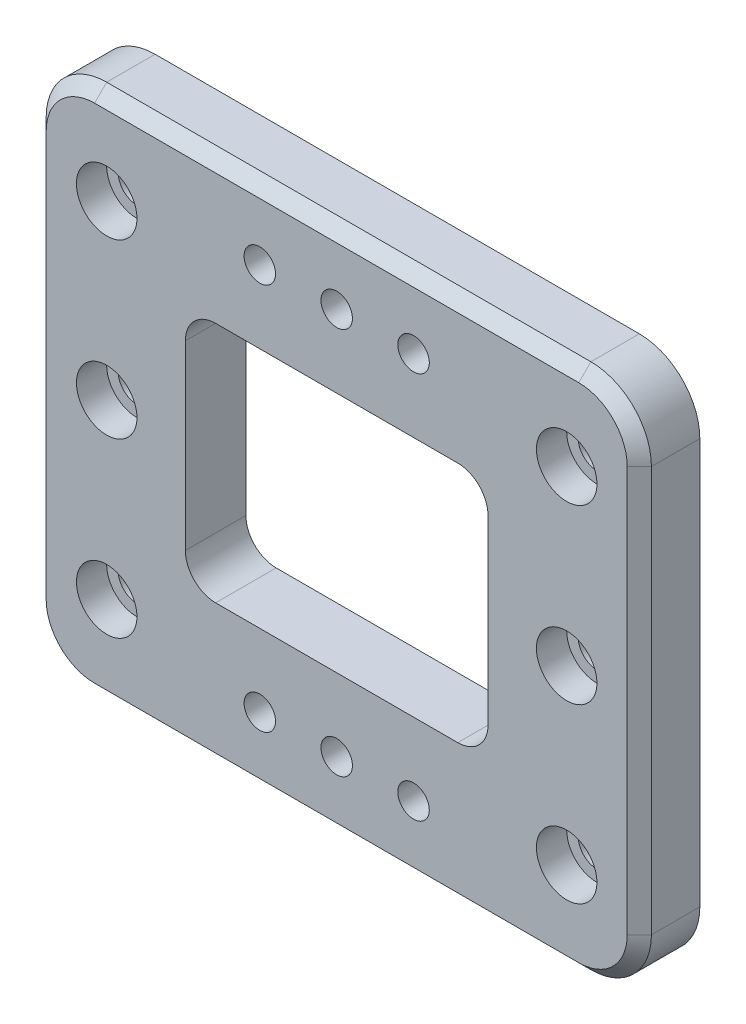
from build123d import *

# Parameters (mm, degrees)
SKETCH_1_W          = 100
SKETCH_1_H          = 87
EXTRUDE_1_DEPTH     = 10
FILLET_1_R          = 10
SKETCH_2_R          = 2.6
CUT_EXTRUDE_1_DEPTH = 10
SKETCH_3_R          = 5
CUT_EXTRUDE_2_DEPTH = 5
SKETCH_4_R          = 3.1
CUT_EXTRUDE_3_DEPTH = 5
CHAMFER_1_SIZE      = 1
CHAMFER_2_SIZE      = 2
SKETCH1_W           = 50
SKETCH1_H           = 40
CUT_EXTRUDE1_DEPTH  = 10
FILLET1_R           = 5


with BuildPart() as part:
    # 草图1 → 凸台-拉伸1 (new body)
    with BuildSketch(Plane.XY):
        Rectangle(SKETCH_1_W, SKETCH_1_H)
    extrude(amount=EXTRUDE_1_DEPTH)

    # 圆角1
    fillet_1_edges = [part.edges().sort_by_distance(p)[0] for p in [
        (50, -43.5, 5),
        (-50, -43.5, 5),
        (-50, 43.5, 5),
        (50, 43.5, 5),
    ]]
    fillet(fillet_1_edges, radius=FILLET_1_R)

    # 草图2 → 切除-拉伸1 (cut)
    with BuildSketch(Plane.XY.offset(10)):
        with Locations((0, 32)):
            Circle(SKETCH_2_R)
        with Locations((-12.7, 32)):
            Circle(SKETCH_2_R)
        with Locations(Location((12.7, 32, 0), (0, 0, 180))):
            Circle(SKETCH_2_R)
        with Locations((-12.7, -32)):
            Circle(SKETCH_2_R)
        with Locations((0, -32)):
            Circle(SKETCH_2_R)
        with Locations((12.7, -32)):
            Circle(SKETCH_2_R)
    extrude(amount=-CUT_EXTRUDE_1_DEPTH, mode=Mode.SUBTRACT)

    # 草图3 → 切除-拉伸2 (cut)
    with BuildSketch(Plane.XY.offset(10)):
        with Locations((-38, 28.5)):
            Circle(SKETCH_3_R)
        with Locations((-38, 0)):
            Circle(SKETCH_3_R)
        with Locations((-38, -28.5)):
            Circle(SKETCH_3_R)
        with Locations(Location((38, -28.5, 0), (0, 0, 180))):
            Circle(SKETCH_3_R)
        with Locations(Location((38, 0, 0), (0, 0, 180))):
            Circle(SKETCH_3_R)
        with Locations(Location((38, 28.5, 0), (0, 0, 180))):
            Circle(SKETCH_3_R)
    extrude(amount=-CUT_EXTRUDE_2_DEPTH, mode=Mode.SUBTRACT)

    # 草图4 → 切除-拉伸3 (cut)
    with BuildSketch(Plane.XY.offset(5)):
        with Locations((-38, 28.5)):
            Circle(SKETCH_4_R)
        with Locations((-38, 0)):
            Circle(SKETCH_4_R)
        with Locations((-38, -28.5)):
            Circle(SKETCH_4_R)
        with Locations((38, 28.5)):
            Circle(SKETCH_4_R)
        with Locations((38, 0)):
            Circle(SKETCH_4_R)
        with Locations((38, -28.5)):
            Circle(SKETCH_4_R)
    extrude(amount=-CUT_EXTRUDE_3_DEPTH, mode=Mode.SUBTRACT)

    # 倒角1
    chamfer_1_edges = [part.edges().sort_by_distance(p)[0] for p in [
        (34.9, 0, 0),
        (34.9, -28.5, 0),
        (-41.1, 28.5, 0),
        (-41.1, 0, 0),
        (-41.1, -28.5, 0),
        (34.9, 28.5, 0),
    ]]
    chamfer(chamfer_1_edges, length=CHAMFER_1_SIZE)

    # 倒角2
    chamfer_2_edges = [part.edges().sort_by_distance(p)[0] for p in [
        (0, 43.5, 10),
        (50, 0, 10),
        (-50, 0, 10),
        (0, -43.5, 10),
        (-47.071067812, -40.571067812, 10),
        (47.071067812, -40.571067812, 10),
        (-47.071067812, 40.571067812, 10),
        (47.071067812, 40.571067812, 10),
    ]]
    chamfer(chamfer_2_edges, length=CHAMFER_2_SIZE)

    # Sketch1 → Cut-Extrude1 (cut)
    with BuildSketch(Plane.XY.offset(10)):
        Rectangle(SKETCH1_W, SKETCH1_H)
    extrude(amount=-CUT_EXTRUDE1_DEPTH, mode=Mode.SUBTRACT)

    # Fillet1
    fillet1_edges = [part.edges().sort_by_distance(p)[0] for p in [
        (25, 20, 5),
        (25, -20, 5),
        (-25, -20, 5),
        (-25, 20, 5),
    ]]
    fillet(fillet1_edges, radius=FILLET1_R)


solid = part.part
